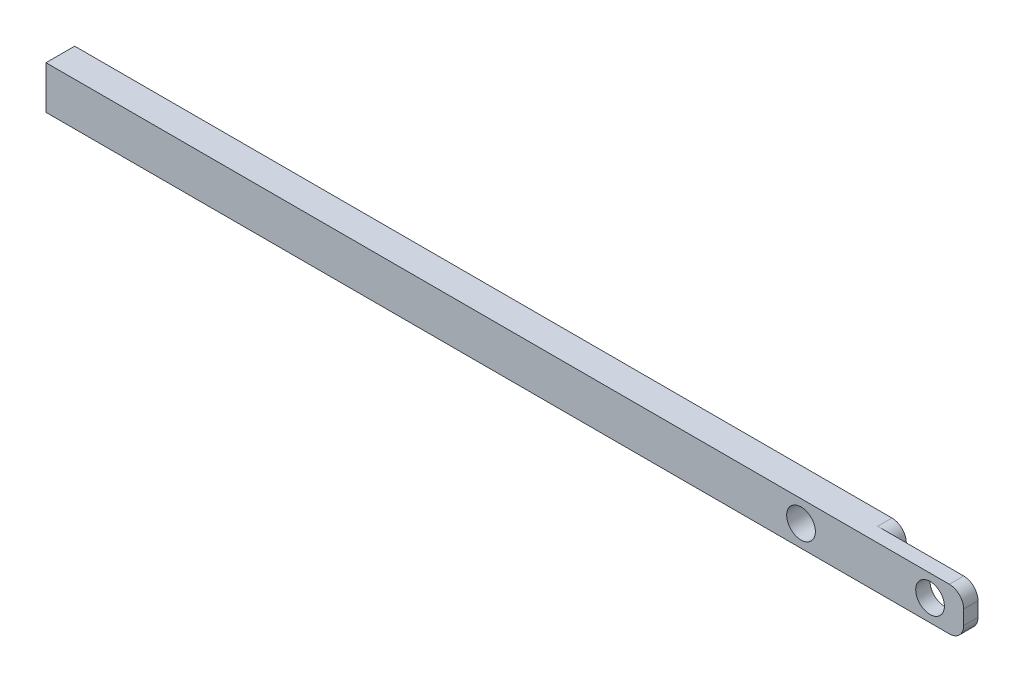
from build123d import *

# Parameters (mm, degrees)
BOSS_EXTRUDE1_DEPTH = 30
FILLET1_R           = 10
SKETCH2_R           = 10
CUT_EXTRUDE1_DEPTH  = 639.630555495


with BuildPart() as part:
    # Sketch1 → Boss-Extrude1 (new body)
    with BuildSketch(Plane(origin=(0, 0, 0), x_dir=(1, 0, 0), z_dir=(0, 1, 0))):
        Polygon((-637.611940299, 61.791044776), (-57.611940299, 61.791044776), (-57.611940299, 51.791044776), (2.388059701, 51.791044776), (2.388059701, 41.791044776), (-17.611940299, 41.791044776), (-637.611940299, 41.791044776), align=None)
    extrude(amount=BOSS_EXTRUDE1_DEPTH)

    # Fillet1
    fillet1_edges = [part.edges().sort_by_distance(p)[0] for p in [
        (2.388059701, 30, -46.791044776),
        (-57.611940299, 30, -56.791044776),
        (-57.611940299, 0, -56.791044776),
        (2.388059701, 0, -46.791044776),
    ]]
    fillet(fillet1_edges, radius=FILLET1_R)

    # Sketch2 → Cut-Extrude1 (cut, through all)
    with BuildSketch(Plane.XY.offset(-41.791044776)):
        with Locations((-21.046360359, 15)):
            Circle(SKETCH2_R)
        with Locations((-111.046360359, 15)):
            Circle(SKETCH2_R)
    extrude(amount=-CUT_EXTRUDE1_DEPTH, mode=Mode.SUBTRACT)


solid = part.part
